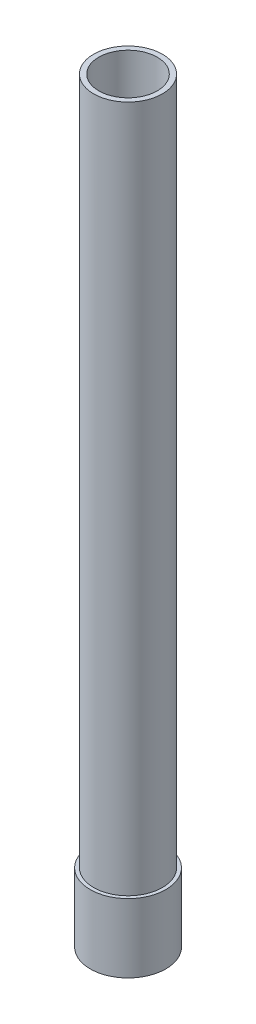
from build123d import *

# Parameters (mm, degrees)
SKETCH1_R           = 10
BOSS_EXTRUDE1_DEPTH = 200
SHELL1_T            = -1.5
SKETCH2_R           = 11
BOSS_EXTRUDE2_DEPTH = 20
SHELL2_T            = -1.5


with BuildPart() as part:
    # Sketch1 → Boss-Extrude1 (new body)
    with BuildSketch(Plane(origin=(0, 0, 0), x_dir=(1, 0, 0), z_dir=(0, 1, 0))):
        with Locations(Location((0, 0, 0), (0, 0, 270))):
            Circle(SKETCH1_R)
    extrude(amount=BOSS_EXTRUDE1_DEPTH)

    # Shell1
    shell1_openings = [part.faces().sort_by_distance(p)[0] for p in [
        (0, 200, 0),
    ]]
    offset(amount=SHELL1_T, openings=shell1_openings, kind=Kind.INTERSECTION)

    # Sketch2 → Boss-Extrude2 (add)
    with BuildSketch(Plane.XZ):
        with Locations(Location((0, 0, 0), (0, 0, 270))):
            Circle(SKETCH2_R)
    extrude(amount=BOSS_EXTRUDE2_DEPTH)

    # Shell2
    shell2_openings = [part.faces().sort_by_distance(p)[0] for p in [
        (0, -20, 0),
    ]]
    offset(amount=SHELL2_T, openings=shell2_openings, kind=Kind.INTERSECTION)


solid = part.part
